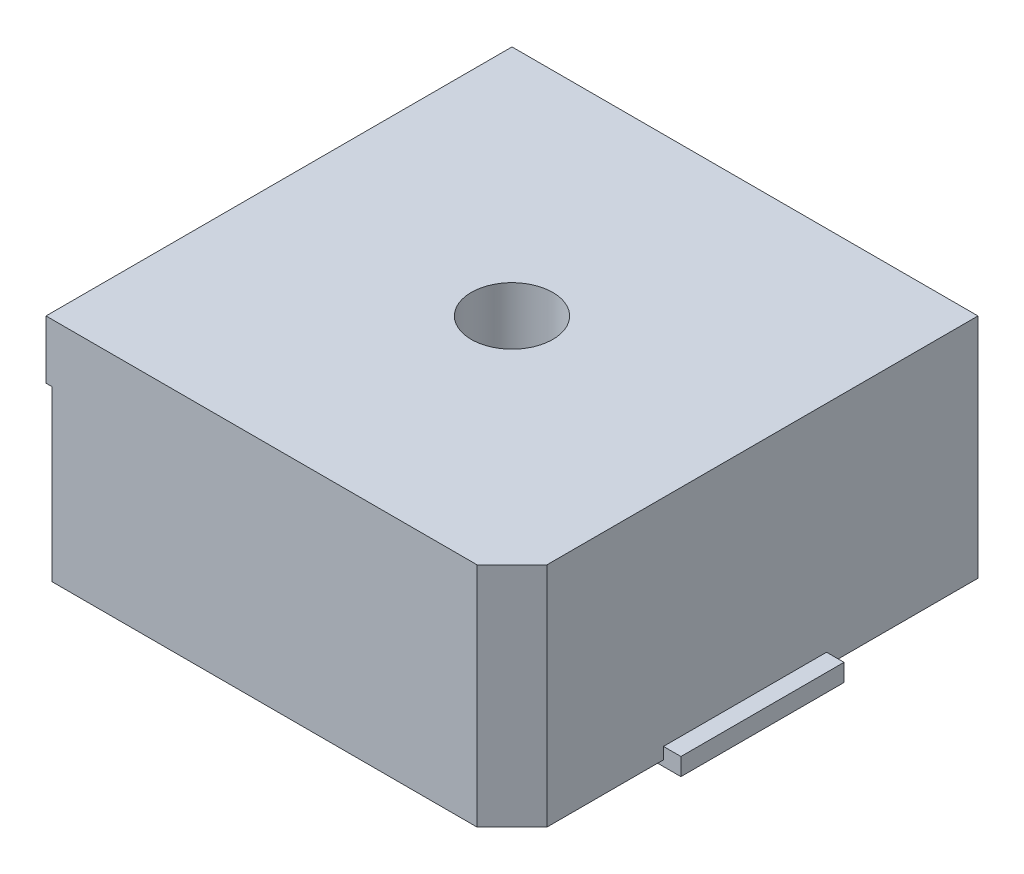
from build123d import *

# Parameters (mm, degrees)
SKETCH1_W           = 4
SKETCH1_H           = 4
BOSS_EXTRUDE1_DEPTH = 2
CUT_EXTRUDE1_DEPTH  = 2
SKETCH3_W           = 1.4
SKETCH3_H           = 0.15
BOSS_EXTRUDE2_DEPTH = 2.15
SKETCH5_R           = 0.35
CUT_EXTRUDE4_DEPTH  = 2
CUT_EXTRUDE5_DEPTH  = 0.05
SKETCH8_R           = 0.1
CUT_EXTRUDE6_DEPTH  = 1.5
CUT_EXTRUDE7_DEPTH  = 0.05


with BuildPart() as part:
    # Sketch1 → Boss-Extrude1 (new body)
    with BuildSketch(Plane(origin=(0, 0, 0), x_dir=(1, 0, 0), z_dir=(0, 1, 0))):
        Rectangle(SKETCH1_W, SKETCH1_H)
    extrude(amount=BOSS_EXTRUDE1_DEPTH)

    # Sketch2 → Cut-Extrude1 (cut)
    with BuildSketch(Plane(origin=(0, 2, 0), x_dir=(1, 0, 0), z_dir=(0, 1, 0))):
        Polygon((2, -1.7), (1.7, -2), (2, -2), align=None)
    extrude(amount=-CUT_EXTRUDE1_DEPTH, mode=Mode.SUBTRACT)

    # Sketch3 → Boss-Extrude2 (add, symmetric)
    with BuildSketch(Plane.ZY):
        with Locations((0, 0.075)):
            Rectangle(SKETCH3_W, SKETCH3_H)
    extrude(amount=BOSS_EXTRUDE2_DEPTH, both=True)

    # Sketch5 → Cut-Extrude4 (cut)
    with BuildSketch(Plane(origin=(0, 0, 0), x_dir=(-1, 0, 0), z_dir=(0, -1, 0))):
        with Locations(Location((0, 0, 0), (0, 0, 90))):
            Circle(SKETCH5_R)
    extrude(amount=-CUT_EXTRUDE4_DEPTH, mode=Mode.SUBTRACT)

    # Sketch7 → Cut-Extrude5 (cut)
    with BuildSketch(Plane.XZ):
        Polygon((2, 0.7), (1.65, 0.7), (1.65, -0.7), (2, -0.7), (2, -2), (-2, -2), (-2, -0.7), (-1.65, -0.7), (-1.65, 0.7), (-2, 0.7), (-2, 2), (1.7, 2), (2, 1.7), align=None)
    extrude(amount=-CUT_EXTRUDE5_DEPTH, mode=Mode.SUBTRACT)

    # Sketch8 → Cut-Extrude6 (cut)
    with BuildSketch(Plane.XZ.offset(-0.05)):
        with Locations(Location((-1, 0, 0), (0, 0, 270))):
            Circle(SKETCH8_R)
        with Locations(Location((1, 0, 0), (0, 0, 270))):
            Circle(SKETCH8_R)
    extrude(amount=-CUT_EXTRUDE6_DEPTH, mode=Mode.SUBTRACT)

    # Sketch9 → Cut-Extrude7 (cut)
    with BuildSketch(Plane.ZY.offset(2)):
        Polygon((-2, 1.5), (-1.875, 1.5), (-1.875, 1.9), (1.875, 1.9), (1.875, 1.5), (2, 1.5), (2, 0.05), (0.75, 0.05), (0.75, 1.7), (-0.75, 1.7), (-0.75, 0.05), (-2, 0.05), align=None)
    extrude(amount=-CUT_EXTRUDE7_DEPTH, mode=Mode.SUBTRACT)


solid = part.part
